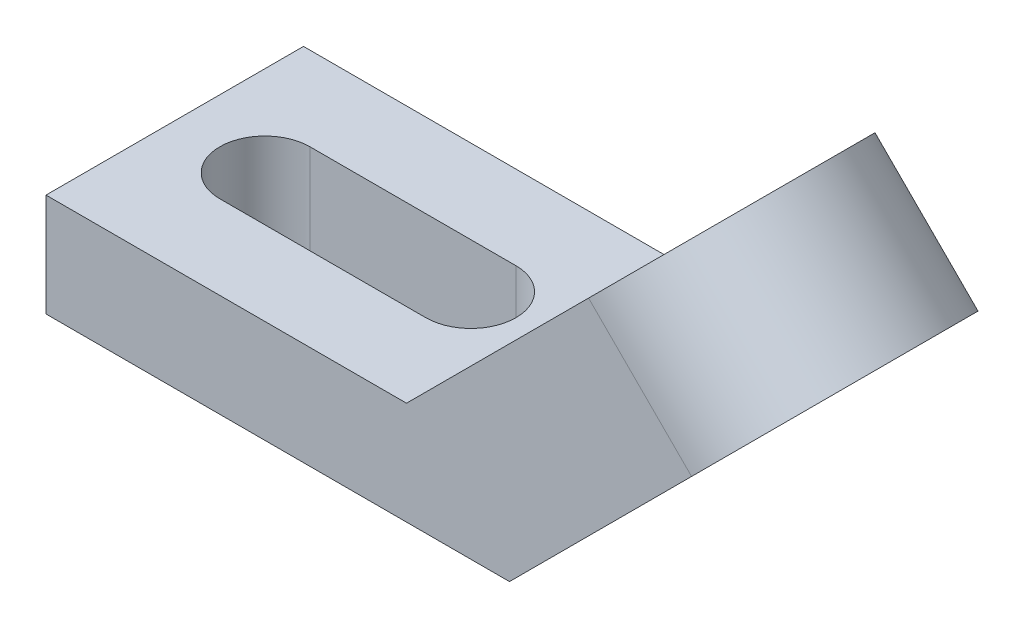
from build123d import *

# Parameters (mm, degrees)
EXTRUDE_1_DEPTH     = 20
FILLET_1_RADIUS     = 10
FILLET_1_LENGTH     = 11.313708499
SKETCH_4_R          = 6
CUT_EXTRUDE_1_DEPTH = 60.222889557
CUT_EXTRUDE_2_DEPTH = 65.213321417


with BuildPart() as part:
    # 草图1 → 凸台-拉伸1 (new body)
    with BuildSketch(Plane.XY):
        Polygon((0, 0), (28, 0), (49.213203436, 21.213203436), (57.213203436, 13.213203436), (36, -8), (0, -8), align=None)
    extrude(amount=-EXTRUDE_1_DEPTH)

    # 圆角1: full round fillet: the end face becomes a half cylinder, R = half its width
    fillet_1_face = Plane((53.213203436, 17.213203436, -10), x_dir=(-0.707106781187, 0.707106781187, 0), z_dir=(0.707106781187, 0.707106781187, 0))  # on the end face: x along it, z out of the body
    fillet_1_slab = fillet_1_face.offset(-FILLET_1_RADIUS / 2) * Box(FILLET_1_LENGTH, 2 * FILLET_1_RADIUS, FILLET_1_RADIUS, mode=Mode.PRIVATE)  # the body's end, R deep
    fillet_1_round = Plane((46.142135624, 10.142135624, -10), x_dir=(0.707106781187, 0.707106781187, 0), z_dir=(-0.707106781187, 0.707106781187, 0)) * Cylinder(FILLET_1_RADIUS, FILLET_1_LENGTH, mode=Mode.PRIVATE)  # its axis R under the face
    add(fillet_1_slab - fillet_1_round, mode=Mode.SUBTRACT)

    # 草图4 → 切除-拉伸1 (cut, through all)
    with BuildSketch(Plane(origin=(14, -14, 0), x_dir=(0, 0, 1), z_dir=(-0.7071067811865488, 0.7071067811865462, 0))):
        with Locations(Location((-10, 39.798989873, 0), (0, 0, 270))):
            Circle(SKETCH_4_R)
    extrude(amount=-CUT_EXTRUDE_1_DEPTH, mode=Mode.SUBTRACT)

    # 草图2 → 切除-拉伸2 (cut, through all)
    with BuildSketch(Plane(origin=(0, 0, 0), x_dir=(1, 0, 0), z_dir=(0, 1, 0))):
        with BuildLine():
            Line((7, 6.5), (23, 6.5))
            ThreePointArc((23, 6.5), (26.5, 10), (23, 13.5))
            Line((23, 13.5), (7, 13.5))
            ThreePointArc((7, 13.5), (3.5, 10), (7, 6.5))
        make_face()
    extrude(amount=-CUT_EXTRUDE_2_DEPTH, mode=Mode.SUBTRACT)


solid = part.part
